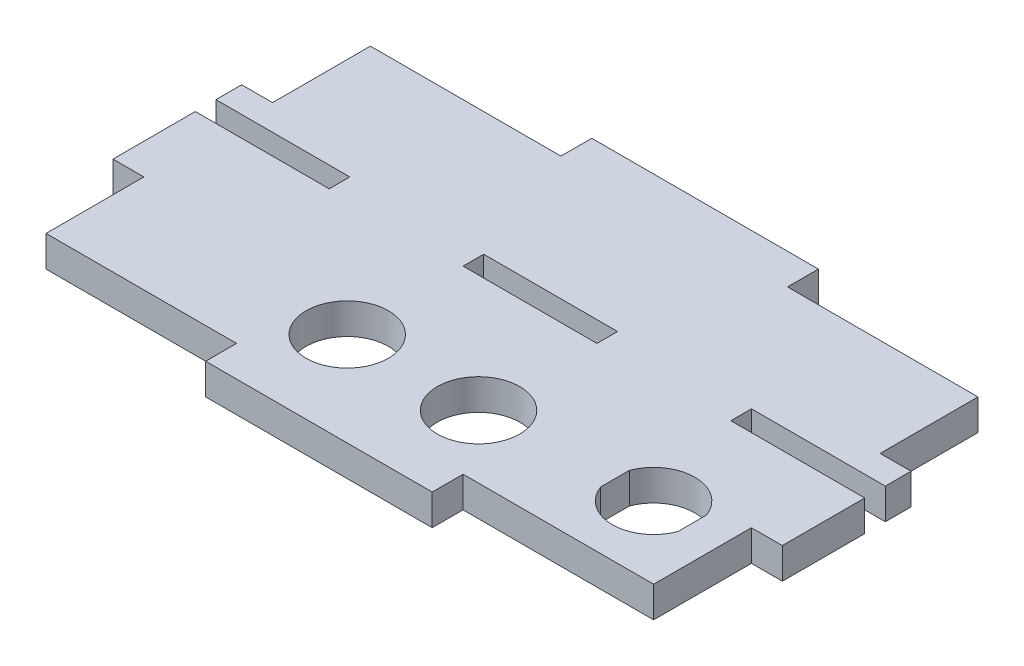
from build123d import *

# Parameters (mm, degrees)
SKETCH1_W           = 130
SKETCH1_H           = 75
BOSS_EXTRUDE1_DEPTH = 6
SKETCH2_R           = 8
CUT_EXTRUDE1_DEPTH  = 151.203195705
SKETCH3_W           = 26
SKETCH3_H           = 4
CUT_EXTRUDE2_DEPTH  = 151.203195705
CUT_EXTRUDE3_DEPTH  = 151.203195705


with BuildPart() as part:
    # Sketch1 → Boss-Extrude1 (new body)
    with BuildSketch(Plane(origin=(0, 0, 0), x_dir=(1, 0, 0), z_dir=(0, 1, 0))):
        with Locations((65, 37.5)):
            Rectangle(SKETCH1_W, SKETCH1_H)
    extrude(amount=BOSS_EXTRUDE1_DEPTH)

    # Sketch2 → Cut-Extrude1 (cut, through all)
    with BuildSketch(Plane(origin=(0, 6, 0), x_dir=(1, 0, 0), z_dir=(0, 1, 0))):
        with Locations(Location((52.25, 18.25, 0), (0, 0, 270))):
            Circle(SKETCH2_R)
        with Locations(Location((77.75, 18.25, 0), (0, 0, 270))):
            Circle(SKETCH2_R)
    extrude(amount=-CUT_EXTRUDE1_DEPTH, mode=Mode.SUBTRACT)

    # Sketch3 → Cut-Extrude2 (cut, through all)
    with BuildSketch(Plane(origin=(0, 6, 0), x_dir=(1, 0, 0), z_dir=(0, 1, 0))):
        Polygon((0, 75), (0, 50), (6, 50), (6, 69), (43, 69), (43, 75), align=None)
        Polygon((87, 75), (87, 69), (124, 69), (124, 50), (130, 50), (130, 75), align=None)
        with Locations((13, 43)):
            Rectangle(SKETCH3_W, SKETCH3_H)
        Polygon((6, 25), (0, 25), (0, 0), (43, 0), (43, 6), (6, 6), align=None)
        with Locations((65, 43)):
            Rectangle(SKETCH3_W, SKETCH3_H)
        with Locations((117, 43)):
            Rectangle(SKETCH3_W, SKETCH3_H)
        Polygon((130, 25), (124, 25), (124, 6), (87, 6), (87, 0), (130, 0), align=None)
    extrude(amount=-CUT_EXTRUDE2_DEPTH, mode=Mode.SUBTRACT)

    # Sketch4 → Cut-Extrude3 (cut, through all)
    with BuildSketch(Plane(origin=(0, 6, 0), x_dir=(1, 0, 0), z_dir=(0, 1, 0))):
        with BuildLine():
            Line((102.5, 22.783882181), (102.5, 17.216117819))
            ThreePointArc((102.5, 17.216117819), (110, 12), (117.5, 17.216117819))
            Line((117.5, 17.216117819), (117.5, 22.783882181))
            ThreePointArc((117.5, 22.783882181), (110, 28), (102.5, 22.783882181))
        make_face()
    extrude(amount=-CUT_EXTRUDE3_DEPTH, mode=Mode.SUBTRACT)


solid = part.part
